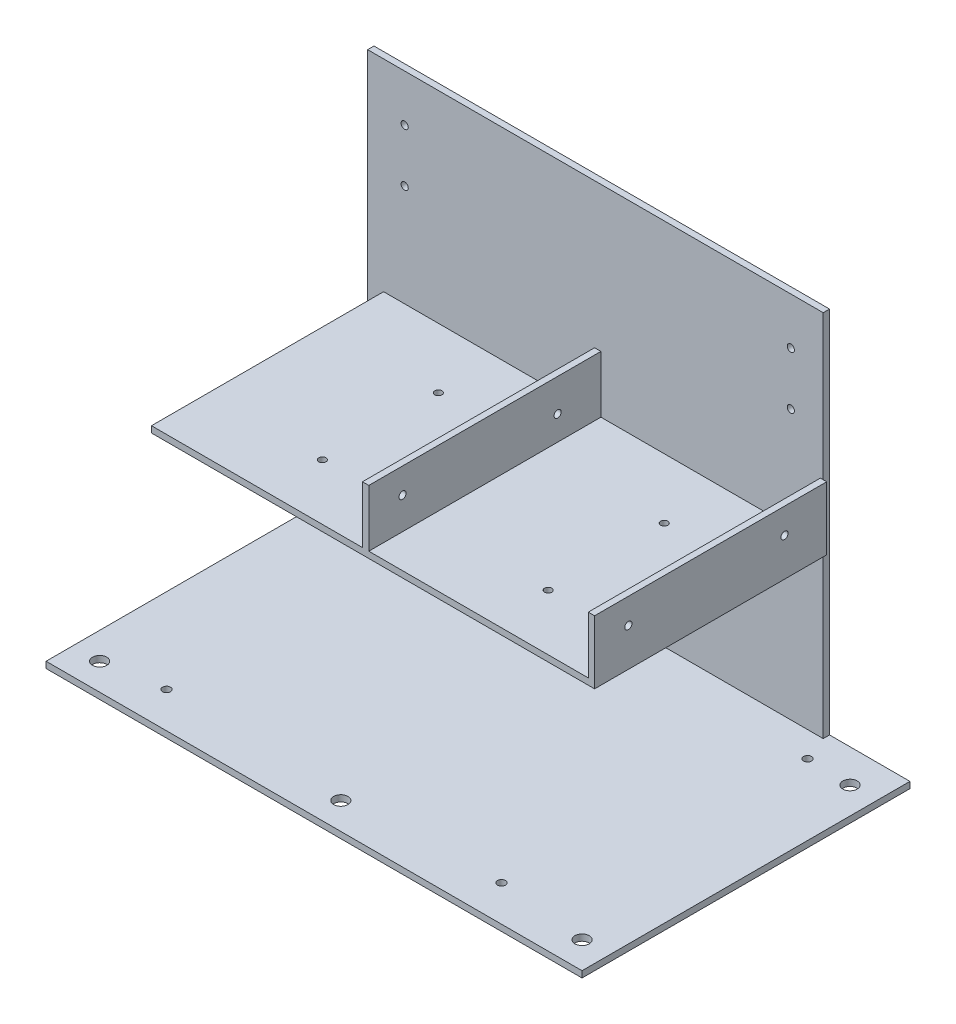
from build123d import *

# Parameters (mm, degrees)
SKETCH1_W                   = 254
SKETCH1_H                   = 152.4
BOSS_EXTRUDE1_DEPTH         = 3
SKETCH2_W                   = 254
SKETCH2_H                   = 177.8
BOSS_EXTRUDE2_DEPTH         = 3
SKETCH3_W                   = 210
SKETCH3_H                   = 30
BOSS_EXTRUDE3_DEPTH         = 110
SKETCH4_W                   = 104
SKETCH4_H                   = 27
SKETCH4_W_2                 = 100
CUT_EXTRUDE1_DEPTH          = 110
F_6_CLEARANCE_HOLE1_D       = 3.7973
F_6_CLEARANCE_HOLE1_DEPTH   = 3
M3_CLEARANCE_HOLE1_D        = 3.4
M3_CLEARANCE_HOLE1_DEPTH    = 3
M3_CLEARANCE_HOLE2_D        = 3.4
M3_CLEARANCE_HOLE2_DEPTH    = 3
M3_CLEARANCE_HOLE3_D        = 3.4
M3_CLEARANCE_HOLE3_DEPTH    = 3
F_1_4_CLEARANCE_HOLE1_D     = 6.7564
F_1_4_CLEARANCE_HOLE1_DEPTH = 3
M3_CLEARANCE_HOLE4_D        = 3.4
CUT_EXTRUDE2_REACH          = 347.477
SKETCH26_W                  = 38.1
SKETCH26_H                  = 174.8


with BuildPart() as part:
    # Sketch1 → Boss-Extrude1 (new body)
    with BuildSketch(Plane(origin=(0, 0, 0), x_dir=(1, 0, 0), z_dir=(0, 1, 0))):
        with Locations((127, -76.2)):
            Rectangle(SKETCH1_W, SKETCH1_H)
    extrude(amount=BOSS_EXTRUDE1_DEPTH)

    # Sketch2 → Boss-Extrude2 (add)
    with BuildSketch(Plane(origin=(0, 0, 0), x_dir=(-1, 0, 0), z_dir=(0, 0, -1))):
        with Locations((-127, 88.9)):
            Rectangle(SKETCH2_W, SKETCH2_H)
    extrude(amount=BOSS_EXTRUDE2_DEPTH)

    # Sketch3 → Boss-Extrude3 (add)
    with BuildSketch(Plane.XY):
        with Locations((112.553077541, 94.2404)):
            Rectangle(SKETCH3_W, SKETCH3_H)
    extrude(amount=BOSS_EXTRUDE3_DEPTH)

    # Sketch4 → Cut-Extrude1 (cut)
    with BuildSketch(Plane.XY.offset(110)):
        with Locations((162.553077541, 95.7404)):
            Rectangle(SKETCH4_W, SKETCH4_H)
        with Locations((57.553077541, 95.7404)):
            Rectangle(SKETCH4_W_2, SKETCH4_H)
    extrude(amount=-CUT_EXTRUDE1_DEPTH, mode=Mode.SUBTRACT)

    # #6 Clearance Hole1
    with Locations(Plane(origin=(0, 0, 0), x_dir=(-1, 0, 0), z_dir=(0, -1, 0))):
        with Locations((-40.113, -11.985), (-40.113, -135.429), (-220.453, -11.985), (-198.863, -135.429)):
            Hole(F_6_CLEARANCE_HOLE1_D / 2, depth=F_6_CLEARANCE_HOLE1_DEPTH)

    # M3 Clearance Hole1
    with Locations(Plane(origin=(0, 79.2404, 0), x_dir=(-1, 0, 0), z_dir=(0, -1, 0))):
        with Locations((-62.053077541, -28.5), (-62.053077541, -83.5), (-169.053077541, -83.5), (-169.053077541, -28.5)):
            Hole(M3_CLEARANCE_HOLE1_D / 2, depth=M3_CLEARANCE_HOLE1_DEPTH)

    # M3 Clearance Hole2
    with Locations(Plane(origin=(110.553077541, 0, 0), x_dir=(0, 0, -1), z_dir=(1, 0, 0))):
        with Locations((-94, 97.2404), (-20.506947641, 93.829062569)):
            Hole(M3_CLEARANCE_HOLE2_D / 2, depth=M3_CLEARANCE_HOLE2_DEPTH)

    # M3 Clearance Hole3
    with Locations(Plane(origin=(217.553077541, 0, 0), x_dir=(0, 0, -1), z_dir=(1, 0, 0))):
        with Locations((-94, 97.2404), (-20, 97.2404)):
            Hole(M3_CLEARANCE_HOLE3_D / 2, depth=M3_CLEARANCE_HOLE3_DEPTH)

    # 1/4 Clearance Hole1
    with Locations(Plane(origin=(0, 3, 0), x_dir=(1, 0, 0), z_dir=(0, 1, 0))):
        with Locations((244.489784516, -272.977286046), (241.3, -139.7), (12.7, -139.7), (12.7, -12.7), (241.3, -12.7), (127, -139.7)):
            Hole(F_1_4_CLEARANCE_HOLE1_D / 2, depth=F_1_4_CLEARANCE_HOLE1_DEPTH)

    # M3 Clearance Hole4 (through all)
    with Locations(Plane.XY):
        with Locations((17.553077541, 155.5904), (17.553077541, 130.5904), (200.553077541, 155.5904), (200.553077541, 130.5904)):
            Hole(M3_CLEARANCE_HOLE4_D / 2)

    # Sketch26 → Cut-Extrude2 (cut, up to next)
    with BuildSketch(Plane.XY, mode=Mode.PRIVATE) as cut_extrude2_sk1:
        with Locations((234.95, 90.4)):
            Rectangle(SKETCH26_W, SKETCH26_H)
    cut_extrude2_tool1 = extrude(cut_extrude2_sk1.sketch, amount=-CUT_EXTRUDE2_REACH, mode=Mode.PRIVATE) & part.part
    add(cut_extrude2_tool1.solids().sort_by_distance((234.95, 90.4, 0))[0], mode=Mode.SUBTRACT)


solid = part.part
